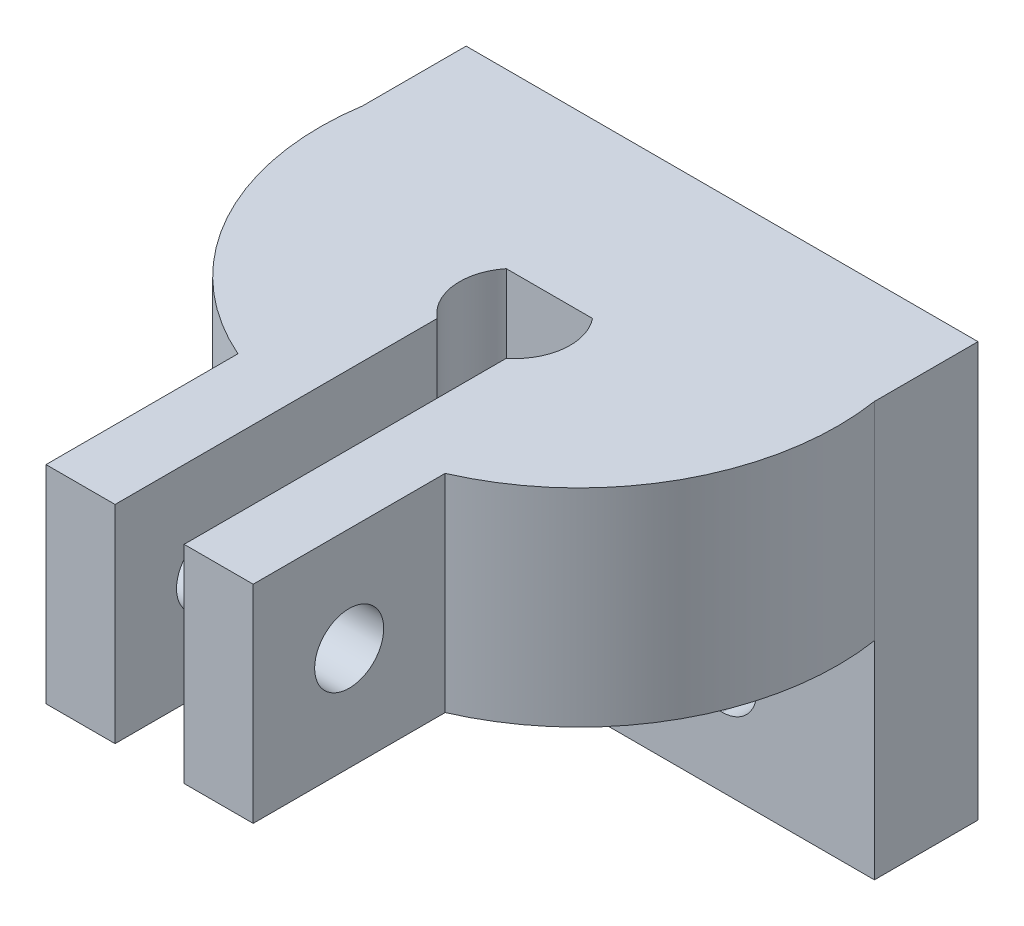
from build123d import *
from build123d.topology import SkipClean

# Parameters (mm, degrees)
BOSS_EXTRUDE1_DEPTH = 6
BOSS_EXTRUDE4_START = 6
BOSS_EXTRUDE4_DEPTH = 6
CUT_EXTRUDE1_DEPTH  = 8
BOSS_EXTRUDE5_START = -12
SKETCH9_W           = 14.823924706
SKETCH9_H           = 3
BOSS_EXTRUDE5_DEPTH = 12
CUT_EXTRUDE3_DEPTH  = 10
CUT_EXTRUDE4_DEPTH  = 17.015617378
SKETCH12_W          = 7
SKETCH12_H          = 6
BOSS_EXTRUDE6_DEPTH = 2
SKETCH13_R          = 1
CUT_EXTRUDE5_DEPTH  = 18.344461472


with BuildPart() as part:
    # Sketch3 → Boss-Extrude1 (new body)
    with BuildSketch(Plane(origin=(0, 0, 0), x_dir=(1, 0, 0), z_dir=(0, 1, 0))):
        with BuildLine():
            Line((-6.25, 4.145780988), (6.25, 4.145780988))
            ThreePointArc((6.25, 4.145780988), (0, -7.5), (-6.25, 4.145780988))
        make_face()
    extrude(amount=BOSS_EXTRUDE1_DEPTH)

    # Sketch7 → Boss-Extrude4 (add)
    with SkipClean():  # the faces are left unmerged after this step: merging them gives an invalid solid
        with BuildSketch(Plane.XZ.offset(BOSS_EXTRUDE4_START)):
            with BuildLine():
                Line((6.25, -4.145780988), (-6.25, -4.145780988))
                ThreePointArc((-6.25, -4.145780988), (-6.993733183, -2.708818223), (-7.411962353, -1.145780988))
                Line((-7.411962353, -1.145780988), (7.411962353, -1.145780988))
                ThreePointArc((7.411962353, -1.145780988), (6.993733183, -2.708818223), (6.25, -4.145780988))
            make_face()
        extrude(amount=-BOSS_EXTRUDE4_DEPTH)

    # Sketch4 → Cut-Extrude1 (cut)
    with SkipClean():  # the faces are left unmerged after this step: merging them gives an invalid solid
        with BuildSketch(Plane(origin=(0, 6, 0), x_dir=(1, 0, 0), z_dir=(0, 1, 0))):
            with BuildLine():
                Line((-1.2489996, -0.854219012), (1.2489996, -0.854219012))
                ThreePointArc((1.2489996, -0.854219012), (0, -3.454219012), (-1.2489996, -0.854219012))
            make_face()
        extrude(amount=-CUT_EXTRUDE1_DEPTH, mode=Mode.SUBTRACT)

    # Sketch9 → Boss-Extrude5 (add)
    with BuildSketch(Plane.XZ.offset(6).offset(BOSS_EXTRUDE5_START)):
        with Locations((0, -2.645780988)):
            Rectangle(SKETCH9_W, SKETCH9_H)
    extrude(amount=BOSS_EXTRUDE5_DEPTH)

    # Sketch8 → Cut-Extrude3 (cut)
    with BuildSketch(Plane.XY.offset(-1.145780988)):
        with BuildLine():
            Line((-3, -2), (3, -2))
            ThreePointArc((3, -2), (4, -3), (3, -4))
            Line((3, -4), (-3, -4))
            ThreePointArc((-3, -4), (-4, -3), (-3, -2))
        make_face()
    extrude(amount=-CUT_EXTRUDE3_DEPTH, mode=Mode.SUBTRACT)

    # Sketch11 → Cut-Extrude4 (cut, through all)
    with BuildSketch(Plane(origin=(0, 6, 0), x_dir=(1, 0, 0), z_dir=(0, 1, 0))):
        with BuildLine():
            Line((-1, -7.433034374), (-1, -3.103218612))
            ThreePointArc((-1, -3.103218612), (0, -3.454219012), (1, -3.103218612))
            Line((1, -3.103218612), (1, -7.433034374))
            ThreePointArc((1, -7.433034374), (0, -7.5), (-1, -7.433034374))
        make_face()
    extrude(amount=-CUT_EXTRUDE4_DEPTH, mode=Mode.SUBTRACT)

    # Sketch12 → Boss-Extrude6 (add)
    with BuildSketch(Plane(origin=(-1, 0, 0), x_dir=(0, 0, -1), z_dir=(1, 0, 0))):
        with Locations((-8.933034374, 3)):
            Rectangle(SKETCH12_W, SKETCH12_H)
    boss_extrude6 = extrude(amount=-BOSS_EXTRUDE6_DEPTH)

    # Mirror1: Boss-Extrude6 across plane
    add(boss_extrude6.mirror(Plane(origin=(0, 0, 0), x_dir=(0, 0, 1), z_dir=(1, 0, 0))))

    # Sketch13 → Cut-Extrude5 (cut, through all)
    with BuildSketch(Plane.ZY.offset(3)):
        with Locations((9.653448958, 3)):
            Circle(SKETCH13_R)
    extrude(amount=-CUT_EXTRUDE5_DEPTH, mode=Mode.SUBTRACT)


solid = part.part
